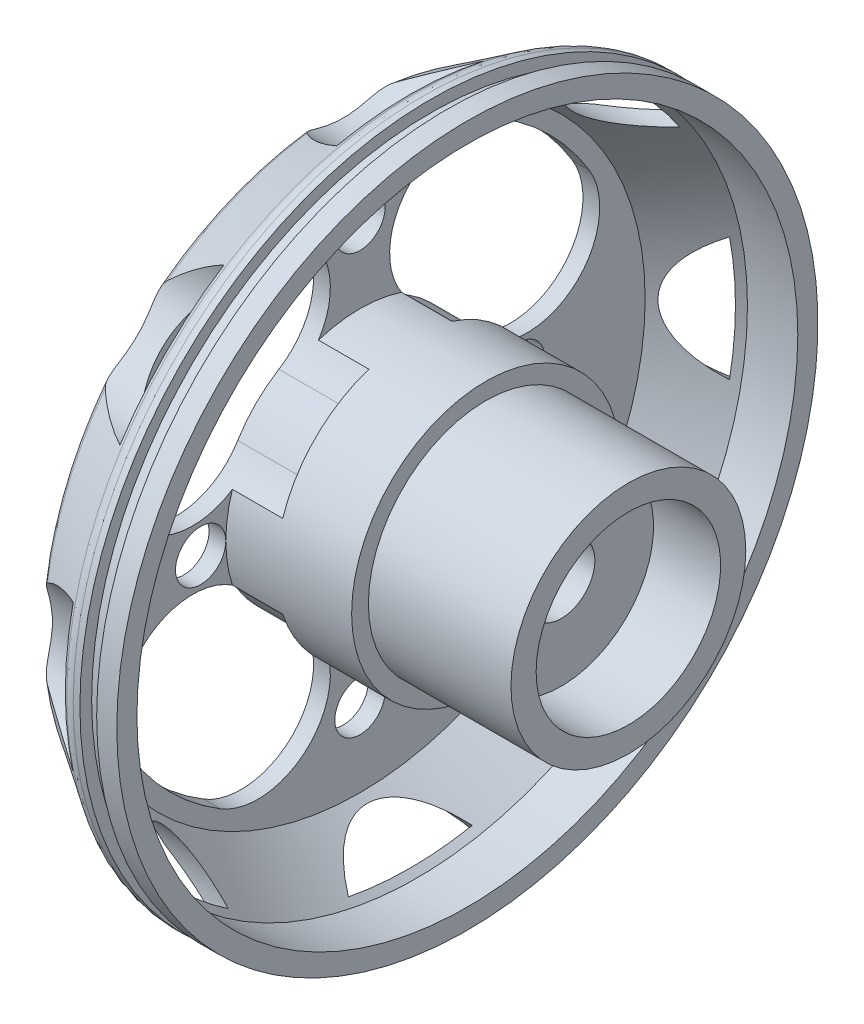
from build123d import *

# Parameters (mm, degrees)
FILLET1_R          = 1
CUT_EXTRUDE2_DEPTH = 4
SKETCH3_R          = 1.5
CUT_EXTRUDE3_DEPTH = 35.097214085


with BuildPart() as part:
    # Sketch1 → Revolve1 (revolve)
    with BuildSketch(Plane.XY, mode=Mode.PRIVATE) as revolve1_sk:
        with BuildLine():
            Line((17, 5.5), (13, 5.5))
            Line((13, 5.5), (13, 2))
            Line((13, 2), (4, 2))
            Line((4, 2), (4, 5.5))
            Line((4, 5.5), (0, 5.5))
            Line((0, 5.5), (0, 18))
            ThreePointArc((0, 18), (2.260998808, 19.432932885), (4.5, 20.9))
            Line((4.5, 20.9), (5.2, 20.9))
            Line((5.2, 20.9), (5.2, 20.2))
            Line((5.2, 20.2), (6.2, 20.2))
            Line((6.2, 20.2), (6.2, 20.9))
            Line((6.2, 20.9), (7.4, 20.9))
            Line((7.4, 20.9), (7.4, 19.7))
            Line((7.4, 19.7), (4.4, 19.7))
            Line((4.4, 19.7), (1, 17))
            Line((1, 17), (1, 8))
            Line((1, 8), (8.5, 8))
            Line((8.5, 8), (8.5, 7))
            Line((8.5, 7), (17, 7))
            Line((17, 7), (17, 5.5))
        make_face()
    revolve(revolve1_sk.sketch.rotate(Axis((0, 0, 0), (1, 0, 0)), 90), axis=Axis((0, 0, 0), (1, 0, 0)))

    # Fillet1
    fillet1_edges = [part.edges().sort_by_distance(p)[0] for p in [
        (0, 0, -18),
        (4.5, 0, -20.9),
    ]]
    fillet(fillet1_edges, radius=FILLET1_R)

    # Sketch2 → Cut-Extrude2 (cut)
    with BuildSketch(Plane.ZY):
        with BuildLine():
            ThreePointArc((13.658899972, 8.332733738), (11.313708499, 11.313708499), (8.332733738, 13.658899972))
            ThreePointArc((8.332733738, 13.658899972), (2.399063586, 12.221821035), (3.836142524, 6.288150883))
            ThreePointArc((3.836142524, 6.288150883), (5.208494552, 5.208494552), (6.288150883, 3.836142524))
            ThreePointArc((6.288150883, 3.836142524), (12.221821035, 2.399063586), (13.658899972, 8.332733738))
        make_face()
        with BuildLine():
            ThreePointArc((8.332733738, -13.658899972), (11.313708499, -11.313708499), (13.658899972, -8.332733738))
            ThreePointArc((13.658899972, -8.332733738), (12.221821035, -2.399063586), (6.288150883, -3.836142524))
            ThreePointArc((6.288150883, -3.836142524), (5.208494552, -5.208494552), (3.836142524, -6.288150883))
            ThreePointArc((3.836142524, -6.288150883), (2.399063586, -12.221821035), (8.332733738, -13.658899972))
        make_face()
        with BuildLine():
            ThreePointArc((-13.658899972, -8.332733738), (-11.313708499, -11.313708499), (-8.332733738, -13.658899972))
            ThreePointArc((-8.332733738, -13.658899972), (-2.399063586, -12.221821035), (-3.836142524, -6.288150883))
            ThreePointArc((-3.836142524, -6.288150883), (-5.208494552, -5.208494552), (-6.288150883, -3.836142524))
            ThreePointArc((-6.288150883, -3.836142524), (-12.221821035, -2.399063586), (-13.658899972, -8.332733738))
        make_face()
        with BuildLine():
            ThreePointArc((-8.332733738, 13.658899972), (-11.313708499, 11.313708499), (-13.658899972, 8.332733738))
            ThreePointArc((-13.658899972, 8.332733738), (-12.221821035, 2.399063586), (-6.288150883, 3.836142524))
            ThreePointArc((-6.288150883, 3.836142524), (-5.208494552, 5.208494552), (-3.836142524, 6.288150883))
            ThreePointArc((-3.836142524, 6.288150883), (-2.399063586, 12.221821035), (-8.332733738, 13.658899972))
        make_face()
        with BuildLine():
            ThreePointArc((11.163174346, 17.471382478), (12.259148591, 12.259148591), (17.471382478, 11.163174346))
            ThreePointArc((17.471382478, 11.163174346), (14.660587764, 14.660587764), (11.163174346, 17.471382478))
        make_face()
        with BuildLine():
            ThreePointArc((20.247689307, 4.460576747), (17.337054201, 0), (20.247689307, -4.460576747))
            ThreePointArc((20.247689307, -4.460576747), (20.733202048, 0), (20.247689307, 4.460576747))
        make_face()
        with BuildLine():
            ThreePointArc((17.471382478, -11.163174346), (12.259148591, -12.259148591), (11.163174346, -17.471382478))
            ThreePointArc((11.163174346, -17.471382478), (14.660587764, -14.660587764), (17.471382478, -11.163174346))
        make_face()
        with BuildLine():
            ThreePointArc((4.460576747, -20.247689307), (0, -17.337054201), (-4.460576747, -20.247689307))
            ThreePointArc((-4.460576747, -20.247689307), (0, -20.733202048), (4.460576747, -20.247689307))
        make_face()
        with BuildLine():
            ThreePointArc((-11.163174346, -17.471382478), (-12.259148591, -12.259148591), (-17.471382478, -11.163174346))
            ThreePointArc((-17.471382478, -11.163174346), (-14.660587764, -14.660587764), (-11.163174346, -17.471382478))
        make_face()
        with BuildLine():
            ThreePointArc((-20.247689307, -4.460576747), (-17.337054201, 0), (-20.247689307, 4.460576747))
            ThreePointArc((-20.247689307, 4.460576747), (-20.733202048, 0), (-20.247689307, -4.460576747))
        make_face()
        with BuildLine():
            ThreePointArc((-17.471382478, 11.163174346), (-12.259148591, 12.259148591), (-11.163174346, 17.471382478))
            ThreePointArc((-11.163174346, 17.471382478), (-14.660587764, 14.660587764), (-17.471382478, 11.163174346))
        make_face()
        with BuildLine():
            ThreePointArc((-4.460576747, 20.247689307), (0, 17.337054201), (4.460576747, 20.247689307))
            ThreePointArc((4.460576747, 20.247689307), (0, 20.733202048), (-4.460576747, 20.247689307))
        make_face()
    extrude(amount=-CUT_EXTRUDE2_DEPTH, mode=Mode.SUBTRACT)

    # Sketch3 → Cut-Extrude3 (cut, through all)
    with BuildSketch(Plane.ZY):
        with Locations((0, 12.5)):
            Circle(SKETCH3_R)
        with Locations((0, -12.5)):
            Circle(SKETCH3_R)
        with Locations((9.5, 0)):
            Circle(SKETCH3_R)
        with Locations((-9.5, 0)):
            Circle(SKETCH3_R)
    extrude(amount=-CUT_EXTRUDE3_DEPTH, mode=Mode.SUBTRACT)


solid = part.part
